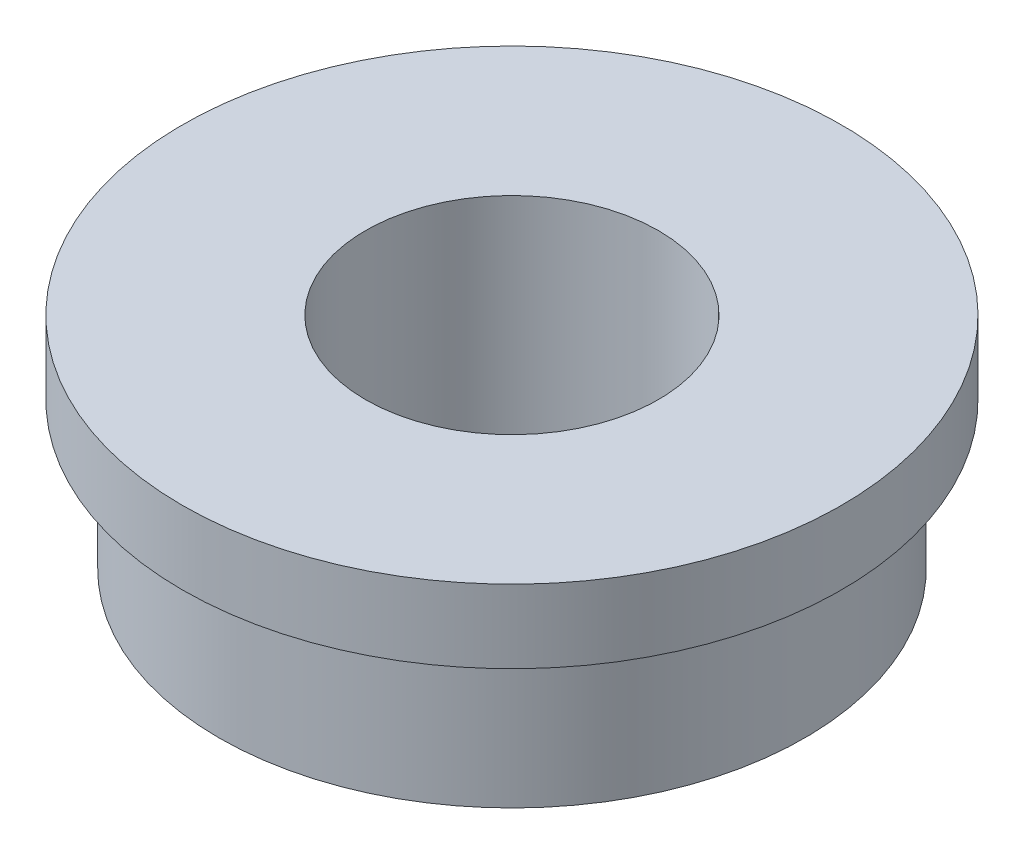
from build123d import *

# Parameters (mm, degrees)
SKETCH_1_R      = 4
SKETCH_1_R_2    = 2
EXTRUDE_1_DEPTH = 2
SKETCH_2_R      = 4.5
SKETCH_2_R_2    = 2
EXTRUDE_2_DEPTH = 1


with BuildPart() as part:
    # 草图1 → 凸台-拉伸1 (new body)
    with BuildSketch(Plane(origin=(0, 0, 0), x_dir=(1, 0, 0), z_dir=(0, 1, 0))):
        with Locations(Location((0, 0, 0), (0, 0, 270))):
            Circle(SKETCH_1_R)
        with Locations(Location((0, 0, 0), (0, 0, 270))):
            Circle(SKETCH_1_R_2, mode=Mode.SUBTRACT)
    extrude(amount=EXTRUDE_1_DEPTH)

    # 草图2 → 凸台-拉伸2 (add)
    with BuildSketch(Plane(origin=(0, 2, 0), x_dir=(1, 0, 0), z_dir=(0, 1, 0))):
        with Locations(Location((0, 0, 0), (0, 0, 270))):
            Circle(SKETCH_2_R)
        with Locations(Location((0, 0, 0), (0, 0, 270))):
            Circle(SKETCH_2_R_2, mode=Mode.SUBTRACT)
    extrude(amount=EXTRUDE_2_DEPTH)


solid = part.part
